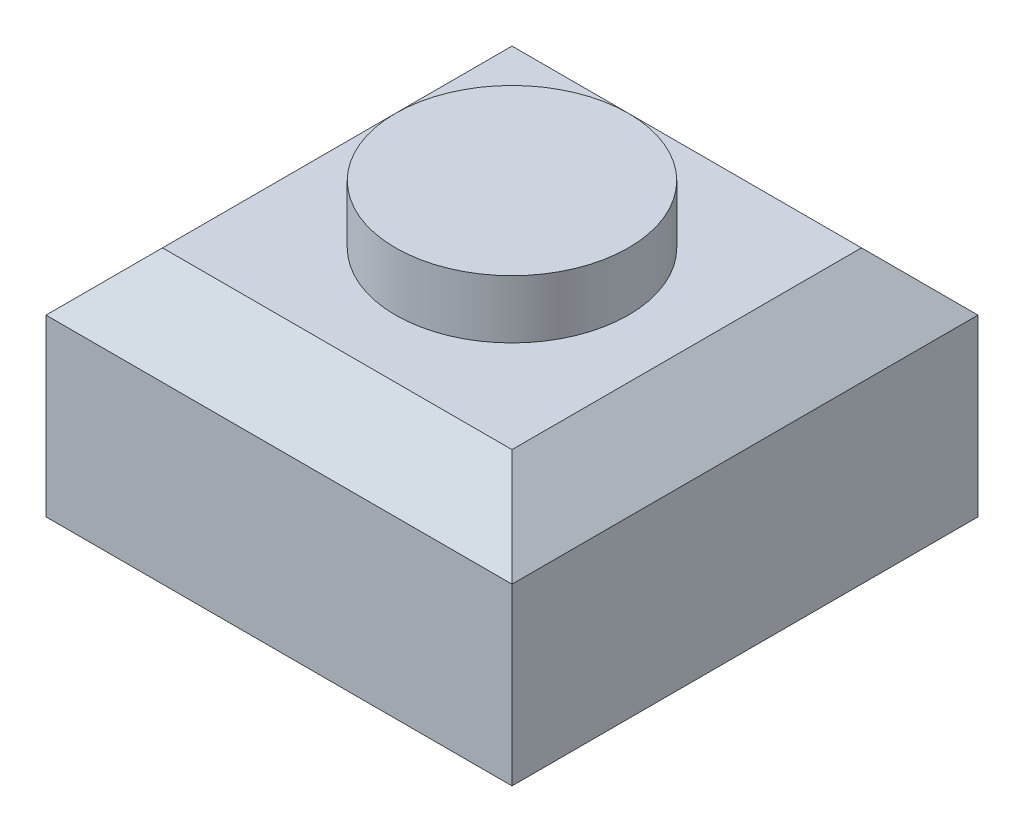
from build123d import *

# Parameters (mm, degrees)
SKETCH4_W           = 80
SKETCH4_H           = 80
BOSS_EXTRUDE1_DEPTH = 40
SKETCH5_R           = 20
BOSS_EXTRUDE2_DEPTH = 10
CHAMFER1_SIZE       = 10


with BuildPart() as part:
    # Sketch4 → Boss-Extrude1 (new body)
    with BuildSketch(Plane(origin=(0, 0, 0), x_dir=(1, 0, 0), z_dir=(0, 1, 0))):
        Rectangle(SKETCH4_W, SKETCH4_H)
    extrude(amount=BOSS_EXTRUDE1_DEPTH)

    # Sketch5 → Boss-Extrude2 (add)
    with BuildSketch(Plane(origin=(0, 40, 0), x_dir=(1, 0, 0), z_dir=(0, 1, 0))):
        with Locations(Location((0, 0, 0), (0, 0, 270))):
            Circle(SKETCH5_R)
    extrude(amount=BOSS_EXTRUDE2_DEPTH)

    # Chamfer1
    chamfer1_edges = [part.edges().sort_by_distance(p)[0] for p in [
        (40, 40, 0),
        (0, 40, -40),
        (-40, 40, 0),
        (0, 40, 40),
    ]]
    chamfer(chamfer1_edges, length=CHAMFER1_SIZE)


solid = part.part
